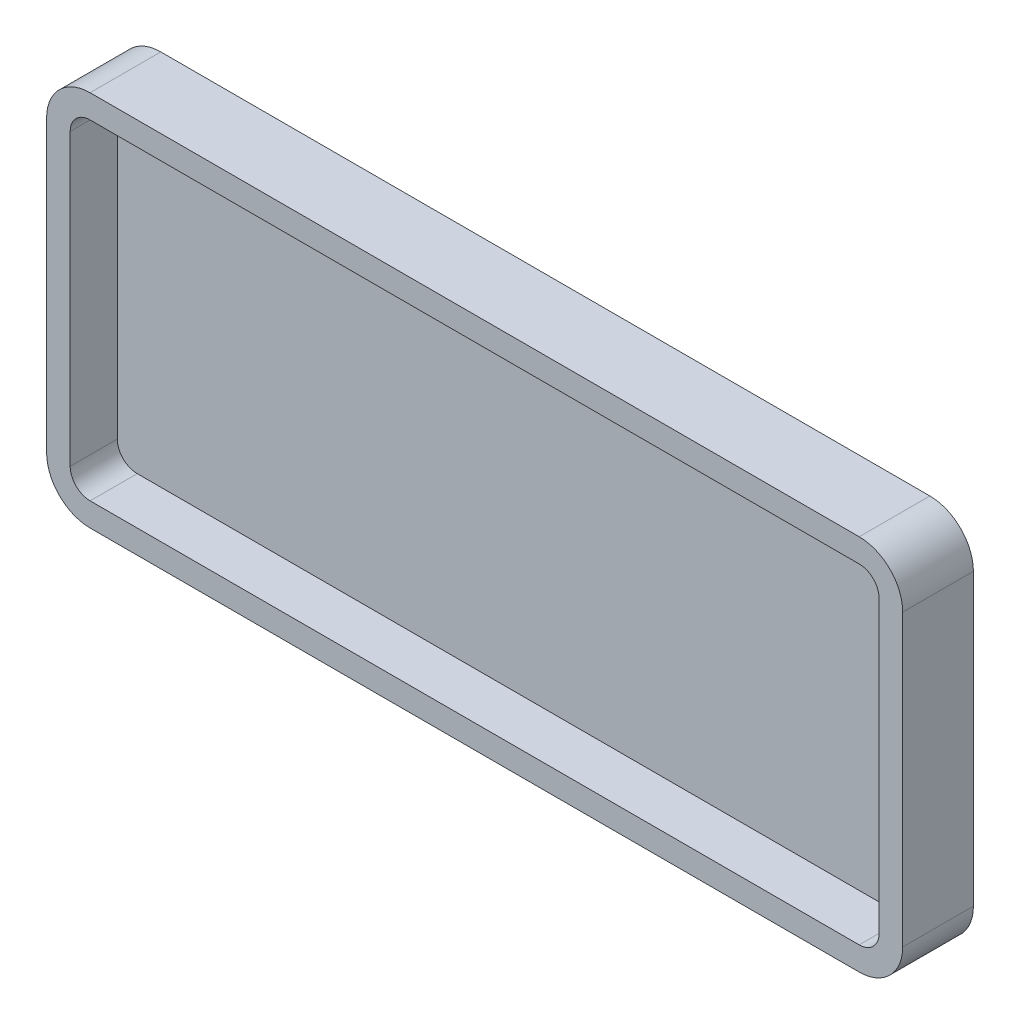
from build123d import *

# Parameters (mm, degrees)
BOSS_EXTRU_1_DEPTH = 3
COQUE1_T           = 1.5


with BuildPart() as part:
    # Esquisse1 → Boss.-Extru.1 (new body)
    with BuildSketch(Plane.XY):
        with BuildLine():
            Line((-24.48, -10.5), (24.48, -10.5))
            ThreePointArc((24.48, -10.5), (25.378025612, -10.128025612), (25.75, -9.23))
            Line((25.75, -9.23), (25.75, 9.23))
            ThreePointArc((25.75, 9.23), (25.378025612, 10.128025612), (24.48, 10.5))
            Line((24.48, 10.5), (-24.48, 10.5))
            ThreePointArc((-24.48, 10.5), (-25.378025612, 10.128025612), (-25.75, 9.23))
            Line((-25.75, 9.23), (-25.75, -9.23))
            ThreePointArc((-25.75, -9.23), (-25.378025612, -10.128025612), (-24.48, -10.5))
        make_face()
    extrude(amount=BOSS_EXTRU_1_DEPTH)

    # Coque1
    coque1_openings = [part.faces().sort_by_distance(p)[0] for p in [
        (0, 0, 3),
    ]]
    offset(amount=COQUE1_T, openings=coque1_openings, kind=Kind.INTERSECTION)


solid = part.part
